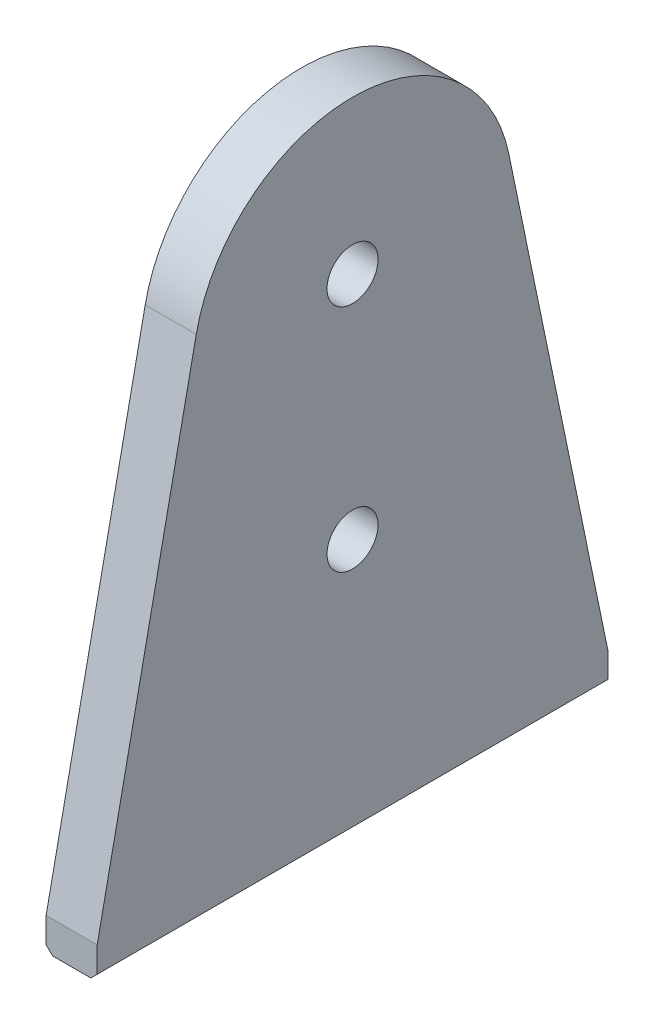
from build123d import *

# Parameters (mm, degrees)
SKETCH1_R           = 4
BOSS_EXTRUDE1_DEPTH = 8
CHAMFER1_SIZE       = 1


with BuildPart() as part:
    # Sketch1 → Boss-Extrude1 (new body)
    with BuildSketch(Plane(origin=(0, 0, 0), x_dir=(0, 0, -1), z_dir=(1, 0, 0))):
        with BuildLine():
            Line((40, 0), (-40, 0))
            Line((-40, 0), (-40, 5))
            Line((-40, 5), (-24.482301542, 80.061315167))
            ThreePointArc((-24.482301542, 80.061315167), (0, 100), (24.482301542, 80.061315167))
            Line((24.482301542, 80.061315167), (40, 5))
            Line((40, 5), (40, 0))
        make_face()
        with Locations((0, 40)):
            Circle(SKETCH1_R, mode=Mode.SUBTRACT)
        with Locations((0, 76)):
            Circle(SKETCH1_R, mode=Mode.SUBTRACT)
    extrude(amount=BOSS_EXTRUDE1_DEPTH)

    # Chamfer1
    chamfer1_edges = [part.edges().sort_by_distance(p)[0] for p in [
        (8, 0, 0),
        (0, 0, 0),
    ]]
    chamfer(chamfer1_edges, length=CHAMFER1_SIZE)


solid = part.part
